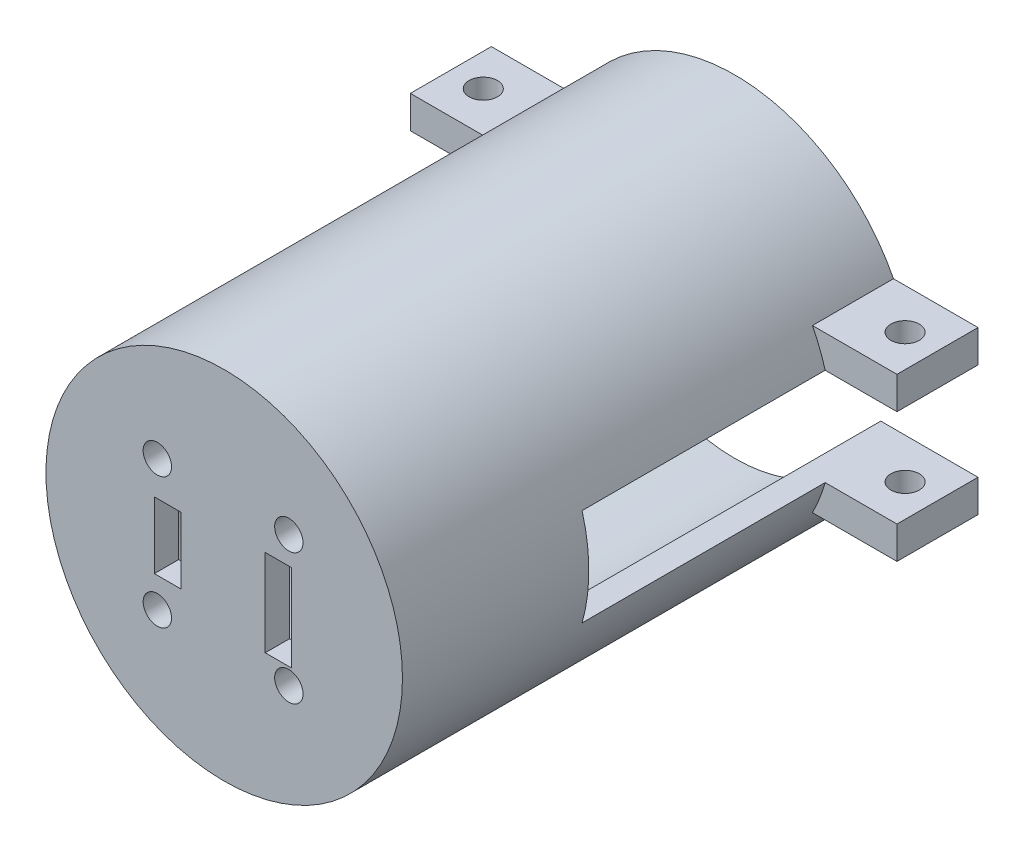
from build123d import *

# Parameters (mm, degrees)
SKETCH1_R           = 22
SKETCH1_R_2         = 19
BOSS_EXTRUDE1_DEPTH = 60
SKETCH2_R           = 22
BOSS_EXTRUDE2_DEPTH = 3
CUT_EXTRUDE1_DEPTH  = 40
SKETCH8_R           = 1.75
SKETCH8_W           = 3.317773355
SKETCH8_H           = 8.204416282
SKETCH8_W_2         = 3.240615835
SKETCH8_H_2         = 10.724895265
CUT_EXTRUDE4_DEPTH  = 68.586980995
SKETCH9_W           = 12
SKETCH9_H           = 4
BOSS_EXTRUDE3_DEPTH = 10
SKETCH10_R          = 1.75
CUT_EXTRUDE5_DEPTH  = 77.776729242


with BuildPart() as part:
    # Sketch1 → Boss-Extrude1 (new body)
    with BuildSketch(Plane.XY):
        Circle(SKETCH1_R)
        Circle(SKETCH1_R_2, mode=Mode.SUBTRACT)
    extrude(amount=BOSS_EXTRUDE1_DEPTH)

    # Sketch2 → Boss-Extrude2 (add)
    with BuildSketch(Plane.XY.offset(60)):
        Circle(SKETCH2_R)
    extrude(amount=BOSS_EXTRUDE2_DEPTH)

    # Sketch3 → Cut-Extrude1 (cut)
    with BuildSketch(Plane(origin=(0, 0, 0), x_dir=(-1, 0, 0), z_dir=(0, 0, -1))):
        with BuildLine():
            Line((-21.166010489, 6), (-18.027756377, 6))
            ThreePointArc((-18.027756377, 6), (-19, 0), (-18.027756377, -6))
            Line((-18.027756377, -6), (-21.166010489, -6))
            ThreePointArc((-21.166010489, -6), (-22, 0), (-21.166010489, 6))
        make_face()
        with BuildLine():
            Line((18.027756377, 6), (21.166010489, 6))
            ThreePointArc((21.166010489, 6), (22, 0), (21.166010489, -6))
            Line((21.166010489, -6), (18.027756377, -6))
            ThreePointArc((18.027756377, -6), (19, 0), (18.027756377, 6))
        make_face()
    extrude(amount=-CUT_EXTRUDE1_DEPTH, mode=Mode.SUBTRACT)

    # Sketch8 → Cut-Extrude4 (cut, through all)
    with BuildSketch(Plane(origin=(0, 0, 60), x_dir=(-1, 0, 0), z_dir=(0, 0, -1))):
        with Locations((-7.976328212, -7.816252109)):
            Circle(SKETCH8_R)
        with Locations((-7.976328212, 8.343747891)):
            Circle(SKETCH8_R)
        with Locations((8.253671788, 8.343747891)):
            Circle(SKETCH8_R)
        with Locations((8.253671788, -7.816252109)):
            Circle(SKETCH8_R)
        with Locations((6.962249116, -0.023129474)):
            Rectangle(SKETCH8_W, SKETCH8_H)
        with Locations((-6.681772319, -0.3831979)):
            Rectangle(SKETCH8_W_2, SKETCH8_H_2)
    extrude(amount=-CUT_EXTRUDE4_DEPTH, mode=Mode.SUBTRACT)

    # Sketch9 → Boss-Extrude3 (add)
    with BuildSketch(Plane(origin=(0, 0, 0), x_dir=(-1, 0, 0), z_dir=(0, 0, -1))):
        with Locations((-24.027756377, 8)):
            Rectangle(SKETCH9_W, SKETCH9_H)
        with Locations((-24.027756377, -8)):
            Rectangle(SKETCH9_W, SKETCH9_H)
        with Locations((24.027756377, -8)):
            Rectangle(SKETCH9_W, SKETCH9_H)
        with Locations((24.027756377, 8)):
            Rectangle(SKETCH9_W, SKETCH9_H)
    extrude(amount=-BOSS_EXTRUDE3_DEPTH)

    # Sketch10 → Cut-Extrude5 (cut, through all)
    with BuildSketch(Plane(origin=(0, 10, 0), x_dir=(1, 0, 0), z_dir=(0, 1, 0))):
        with Locations(Location((-26.027756377, -5, 0), (0, 0, 180))):
            Circle(SKETCH10_R)
        with Locations((26.027756377, -5)):
            Circle(SKETCH10_R)
    extrude(amount=-CUT_EXTRUDE5_DEPTH, mode=Mode.SUBTRACT)


solid = part.part
